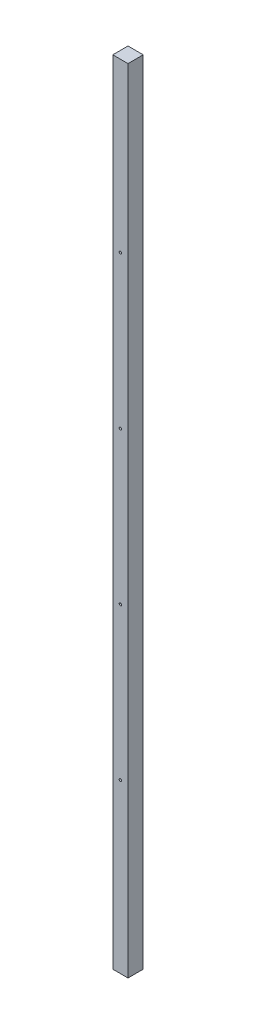
from build123d import *

# Parameters (mm, degrees)
SKETCH_1_W          = 50
SKETCH_1_H          = 50
EXTRUDE_1_DEPTH     = 2600
SKETCH_2_R          = 4
CUT_EXTRUDE_1_DEPTH = 100


with BuildPart() as part:
    # Эскиз1 → Бобышка-Вытянуть1 (new body)
    with BuildSketch(Plane(origin=(0, 0, 0), x_dir=(1, 0, 0), z_dir=(0, 1, 0))):
        Rectangle(SKETCH_1_W, SKETCH_1_H)
    extrude(amount=EXTRUDE_1_DEPTH)

    # Эскиз2 → Вырез-Вытянуть1 (cut)
    with BuildSketch(Plane.XY.offset(25)):
        with Locations((0, 2050)):
            Circle(SKETCH_2_R)
        with Locations((0, 1550)):
            Circle(SKETCH_2_R)
        with Locations((0, 1050)):
            Circle(SKETCH_2_R)
        with Locations((0, 550)):
            Circle(SKETCH_2_R)
    extrude(amount=-CUT_EXTRUDE_1_DEPTH, mode=Mode.SUBTRACT)


solid = part.part
